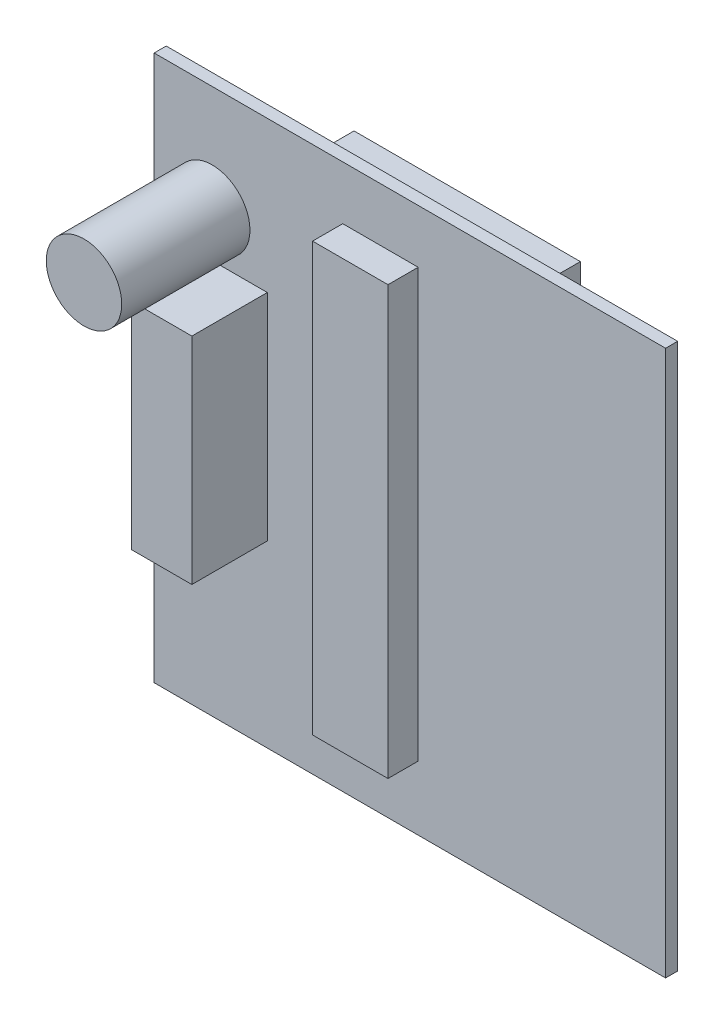
from build123d import *

# Parameters (mm, degrees)
SKETCH1_W           = 67.8
SKETCH1_H           = 72.3
BOSS_EXTRUDE1_DEPTH = 1.6
SKETCH3_W           = 10
SKETCH3_H           = 56.699897886
BOSS_EXTRUDE2_DEPTH = 4
SKETCH4_W           = 8
SKETCH4_H           = 28.525313837
BOSS_EXTRUDE3_DEPTH = 10
SKETCH5_R           = 5
BOSS_EXTRUDE4_DEPTH = 17
SKETCH6_W           = 30
SKETCH6_H           = 59.3
BOSS_EXTRUDE5_DEPTH = 10


with BuildPart() as part:
    # Sketch1 → Boss-Extrude1 (new body)
    with BuildSketch(Plane.XY):
        with Locations((-4.278640777, 17.784757282)):
            Rectangle(SKETCH1_W, SKETCH1_H)
    extrude(amount=BOSS_EXTRUDE1_DEPTH)

    # Sketch3 → Boss-Extrude2 (add)
    with BuildSketch(Plane.XY.offset(1.6)):
        with Locations((-8.178640777, 18.484808339)):
            Rectangle(SKETCH3_W, SKETCH3_H)
    extrude(amount=BOSS_EXTRUDE2_DEPTH)

    # Sketch4 → Boss-Extrude3 (add)
    with BuildSketch(Plane.XY.offset(1.6)):
        with Locations((-27.178640777, 19.672100364)):
            Rectangle(SKETCH4_W, SKETCH4_H)
    extrude(amount=BOSS_EXTRUDE3_DEPTH)

    # Sketch5 → Boss-Extrude4 (add)
    with BuildSketch(Plane.XY.offset(1.6)):
        with Locations((-30.478640777, 39.934757282)):
            Circle(SKETCH5_R)
    extrude(amount=BOSS_EXTRUDE4_DEPTH)

    # Sketch6 → Boss-Extrude5 (add)
    with BuildSketch(Plane(origin=(0, 0, 0), x_dir=(-1, 0, 0), z_dir=(0, 0, -1))):
        with Locations((8.278640777, 16.984757282)):
            Rectangle(SKETCH6_W, SKETCH6_H)
    extrude(amount=BOSS_EXTRUDE5_DEPTH)


solid = part.part
